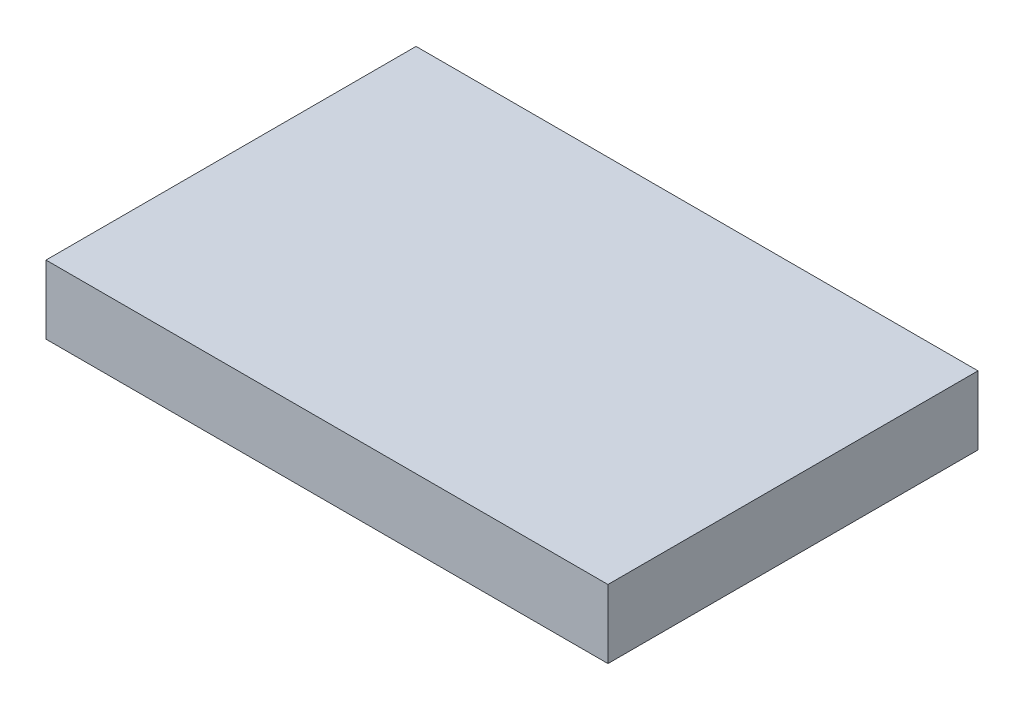
from build123d import *

# Parameters (mm, degrees)
SKETCH1_W           = 82
SKETCH1_H           = 54
BOSS_EXTRUDE1_DEPTH = 10


with BuildPart() as part:
    # Sketch1 → Boss-Extrude1 (new body)
    with BuildSketch(Plane(origin=(0, 0, 0), x_dir=(1, 0, 0), z_dir=(0, 1, 0))):
        with Locations((41, 27)):
            Rectangle(SKETCH1_W, SKETCH1_H)
    extrude(amount=BOSS_EXTRUDE1_DEPTH)


solid = part.part
